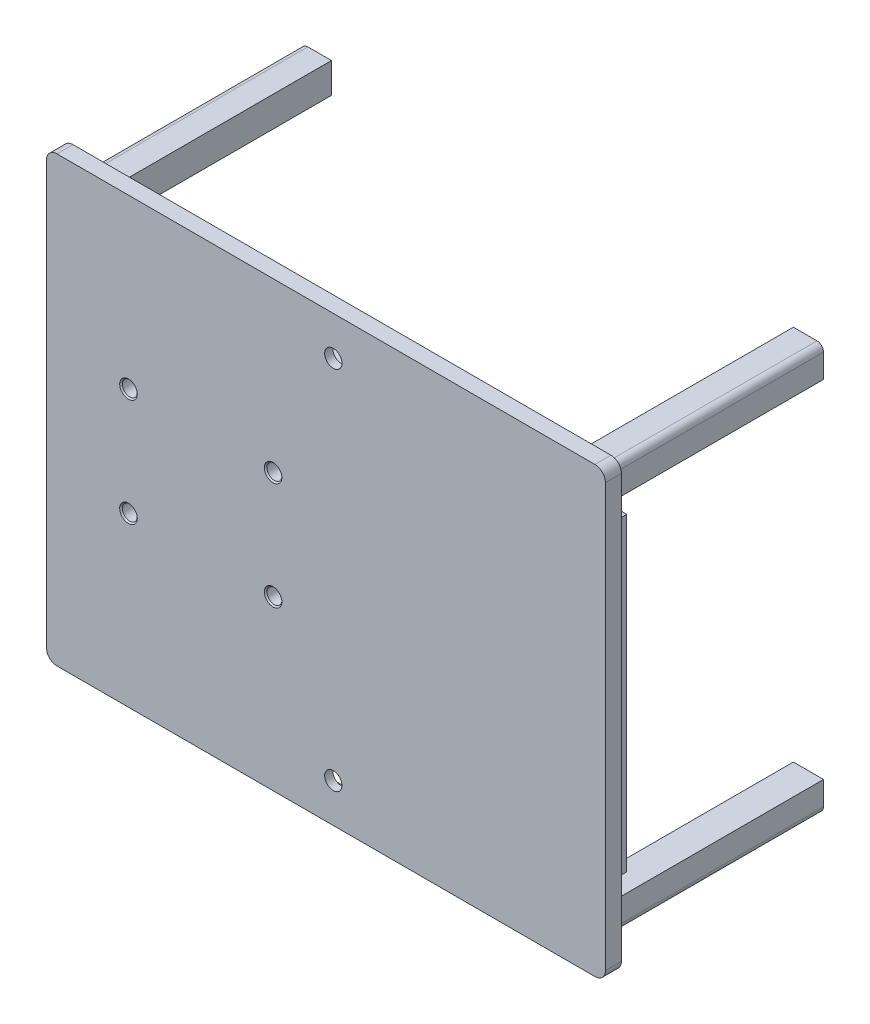
from build123d import *

# Parameters (mm, degrees)
SALIENTE_EXTRUIR1_DEPTH          = 3.1
SALIENTE_EXTRUIR2_DEPTH          = 3
SALIENTE_EXTRUIR3_DEPTH          = 3
TALADRO_DE_MARGEN_PARA_M41_D     = 4.5
TALADRO_DE_MARGEN_PARA_M41_DEPTH = 8.2
TALADRO_DE_MARGEN_PARA_M41_TIP   = 1.351936393
CROQUIS10_W                      = 11.5
CROQUIS10_H                      = 11.5
SALIENTE_EXTRUIR4_DEPTH          = 87
SALIENTE_EXTRUIR5_DEPTH          = 12
CROQUIS14_R                      = 2
CORTAR_EXTRUIR1_DEPTH            = 6
CHAFL_N1_SIZE                    = 0.3
TALADRO_DE_MARGEN_PARA_M61_D     = 6.6
TALADRO_DE_MARGEN_PARA_M61_DEPTH = 8.2
TALADRO_DE_MARGEN_PARA_M61_TIP   = 1.982840043
CORTAR_EXTRUIR3_DEPTH            = 12
REDONDEO1_R                      = 2.5
CROQUIS19_R                      = 6.15
SALIENTE_EXTRUIR6_DEPTH          = 12
CROQUIS20_R                      = 2.85
CORTAR_EXTRUIR4_DEPTH            = 8.2
CHAFL_N2_SIZE                    = 0.5


with BuildPart() as part:
    # Croquis4 → Saliente-Extruir1 (new body)
    with BuildSketch(Plane(origin=(0, 0, 6.1), x_dir=(-1, 0, 0), z_dir=(0, 0, -1))):
        with BuildLine():
            Line((-120.1, -80.5), (-120.1, 80.5))
            ThreePointArc((-120.1, 80.5), (-121.271572875, 83.328427125), (-124.1, 84.5))
            Line((-124.1, 84.5), (-329.1, 84.5))
            ThreePointArc((-329.1, 84.5), (-331.928427125, 83.328427125), (-333.1, 80.5))
            Line((-333.1, 80.5), (-333.1, -80.5))
            ThreePointArc((-333.1, -80.5), (-331.928427125, -83.328427125), (-329.1, -84.5))
            Line((-329.1, -84.5), (-124.1, -84.5))
            ThreePointArc((-124.1, -84.5), (-121.271572875, -83.328427125), (-120.1, -80.5))
        make_face()
    extrude(amount=SALIENTE_EXTRUIR1_DEPTH)



with BuildPart() as body_2:
    # Croquis5 → Saliente-Extruir2 (new body)
    with BuildSketch(Plane(origin=(0, 0, 3), x_dir=(-1, 0, 0), z_dir=(0, 0, -1))):
        with BuildLine():
            Line((-326.1, 59), (-326.1, -59))
            Line((-326.1, -59), (-326.1, -75))
            ThreePointArc((-326.1, -75), (-325.367766953, -76.767766953), (-323.6, -77.5))
            Line((-323.6, -77.5), (-129.6, -77.5))
            ThreePointArc((-129.6, -77.5), (-127.832233047, -76.767766953), (-127.1, -75))
            Line((-127.1, -75), (-127.1, 75))
            ThreePointArc((-127.1, 75), (-127.832233047, 76.767766953), (-129.6, 77.5))
            Line((-129.6, 77.5), (-323.6, 77.5))
            ThreePointArc((-323.6, 77.5), (-325.367766953, 76.767766953), (-326.1, 75))
            Line((-326.1, 75), (-326.1, 59))
        make_face()
        with BuildLine():
            Line((-324.1, 59), (-324.1, -59))
            Line((-324.1, -59), (-324.1, -75))
            ThreePointArc((-324.1, -75), (-323.953553391, -75.353553391), (-323.6, -75.5))
            Line((-323.6, -75.5), (-129.6, -75.5))
            ThreePointArc((-129.6, -75.5), (-129.246446609, -75.353553391), (-129.1, -75))
            Line((-129.1, -75), (-129.1, 75))
            ThreePointArc((-129.1, 75), (-129.246446609, 75.353553391), (-129.6, 75.5))
            Line((-129.6, 75.5), (-323.6, 75.5))
            ThreePointArc((-323.6, 75.5), (-323.953553391, 75.353553391), (-324.1, 75))
            Line((-324.1, 75), (-324.1, 59))
        make_face(mode=Mode.SUBTRACT)
    extrude(amount=SALIENTE_EXTRUIR2_DEPTH)


with BuildPart() as part_1:
    add(part.part)

    add(body_2.part)  # Saliente-Extruir3 merges body 2
    # Croquis6 → Saliente-Extruir3 (add)
    with BuildSketch(Plane(origin=(0, 0, 3), x_dir=(-1, 0, 0), z_dir=(0, 0, -1))):
        with BuildLine():
            Line((-120.1, -80.5), (-120.1, 80.5))
            ThreePointArc((-120.1, 80.5), (-121.271572875, 83.328427125), (-124.1, 84.5))
            Line((-124.1, 84.5), (-329.1, 84.5))
            ThreePointArc((-329.1, 84.5), (-331.928427125, 83.328427125), (-333.1, 80.5))
            Line((-333.1, 80.5), (-333.1, -80.5))
            ThreePointArc((-333.1, -80.5), (-331.928427125, -83.328427125), (-329.1, -84.5))
            Line((-329.1, -84.5), (-124.1, -84.5))
            ThreePointArc((-124.1, -84.5), (-121.271572875, -83.328427125), (-120.1, -80.5))
        make_face()
        with BuildLine():
            Line((-122.1, -80.5), (-122.1, 80.5))
            ThreePointArc((-122.1, 80.5), (-122.685786438, 81.914213562), (-124.1, 82.5))
            Line((-124.1, 82.5), (-329.1, 82.5))
            ThreePointArc((-329.1, 82.5), (-330.514213562, 81.914213562), (-331.1, 80.5))
            Line((-331.1, 80.5), (-331.1, -80.5))
            ThreePointArc((-331.1, -80.5), (-330.514213562, -81.914213562), (-329.1, -82.5))
            Line((-329.1, -82.5), (-124.1, -82.5))
            ThreePointArc((-124.1, -82.5), (-122.685786438, -81.914213562), (-122.1, -80.5))
        make_face(mode=Mode.SUBTRACT)
    extrude(amount=SALIENTE_EXTRUIR3_DEPTH)

    # Taladro de margen para M41
    with Locations(Plane.XY.offset(6.1)):
        with Locations((151.35, 20.5), (206.45, 20.5), (206.45, -20.5), (151.35, -20.5)):
            Hole(TALADRO_DE_MARGEN_PARA_M41_D / 2, depth=TALADRO_DE_MARGEN_PARA_M41_DEPTH)
            with Locations((0, 0, -(TALADRO_DE_MARGEN_PARA_M41_DEPTH + TALADRO_DE_MARGEN_PARA_M41_TIP / 2))):  # 118° drill point
                Cone(0, TALADRO_DE_MARGEN_PARA_M41_D / 2, TALADRO_DE_MARGEN_PARA_M41_TIP, mode=Mode.SUBTRACT)

    # Croquis10 → Saliente-Extruir4 (add)
    with BuildSketch(Plane(origin=(0, 0, 3), x_dir=(-1, 0, 0), z_dir=(0, 0, -1))):
        with Locations((-132.85, 71.75)):
            Rectangle(CROQUIS10_W, CROQUIS10_H)
        with Locations((-132.85, -71.75)):
            Rectangle(CROQUIS10_W, CROQUIS10_H)
        with Locations((-320.35, -71.75)):
            Rectangle(CROQUIS10_W, CROQUIS10_H)
        with Locations((-320.35, 71.75)):
            Rectangle(CROQUIS10_W, CROQUIS10_H)
    extrude(amount=SALIENTE_EXTRUIR4_DEPTH)

    # Croquis13 → Saliente-Extruir5 (add)
    with BuildSketch(Plane(origin=(0, 0, 3), x_dir=(-1, 0, 0), z_dir=(0, 0, -1))):
        Polygon((-213.1, -55), (-323.1, -55), (-323.1, 55), (-213.1, 55), (-213.1, 21.5), (-209.1, 21.5), (-209.1, 59), (-326.1, 59), (-326.1, -59), (-209.1, -59), (-209.1, -21.5), (-213.1, -21.5), align=None)
    extrude(amount=SALIENTE_EXTRUIR5_DEPTH)

    # Croquis14 → Cortar-Extruir1 (cut)
    with BuildSketch(Plane(origin=(0, 0, -84), x_dir=(-1, 0, 0), z_dir=(0, 0, -1))):
        with Locations((-132.85, -71.75)):
            Circle(CROQUIS14_R)
        with Locations((-132.85, 71.75)):
            Circle(CROQUIS14_R)
        with Locations((-320.35, 71.75)):
            Circle(CROQUIS14_R)
        with Locations((-320.35, -71.75)):
            Circle(CROQUIS14_R)
    extrude(amount=-CORTAR_EXTRUIR1_DEPTH, mode=Mode.SUBTRACT)

    # Chaflán1
    chafl_n1_edges = [part_1.edges().sort_by_distance(p)[0] for p in [
        (322.35, -71.75, -84),
        (322.35, 71.75, -84),
        (134.85, 71.75, -84),
        (134.85, -71.75, -84),
    ]]
    chamfer(chafl_n1_edges, length=CHAFL_N1_SIZE)

    # Taladro de margen para M61
    with Locations(Plane.XY.offset(6.1)):
        with Locations((229.4, 69.675), (229.4, -69.675)):
            Hole(TALADRO_DE_MARGEN_PARA_M61_D / 2, depth=TALADRO_DE_MARGEN_PARA_M61_DEPTH)
            with Locations((0, 0, -(TALADRO_DE_MARGEN_PARA_M61_DEPTH + TALADRO_DE_MARGEN_PARA_M61_TIP / 2))):  # 118° drill point
                Cone(0, TALADRO_DE_MARGEN_PARA_M61_D / 2, TALADRO_DE_MARGEN_PARA_M61_TIP, mode=Mode.SUBTRACT)

    # Croquis18 → Cortar-Extruir3 (cut)
    with BuildSketch(Plane(origin=(0, 0, -9), x_dir=(-1, 0, 0), z_dir=(0, 0, -1))):
        Polygon((-212.6, 21.5), (-212.6, 55.5), (-323.6, 55.5), (-323.6, -55.5), (-212.6, -55.5), (-212.6, -21.5), (-213.1, -21.5), (-213.1, -55), (-323.1, -55), (-323.1, 55), (-213.1, 55), (-213.1, 21.5), align=None)
    extrude(amount=-CORTAR_EXTRUIR3_DEPTH, mode=Mode.SUBTRACT)

    # Redondeo1
    redondeo1_edges = [part_1.edges().sort_by_distance(p)[0] for p in [
        (127.1, 77.5, -40.5),
        (127.1, -77.5, -40.5),
        (326.1, -77.5, -40.5),
        (326.1, 77.5, -40.5),
    ]]
    fillet(redondeo1_edges, radius=REDONDEO1_R)

    # Croquis19 → Saliente-Extruir6 (add)
    with BuildSketch(Plane(origin=(0, 0, 3), x_dir=(-1, 0, 0), z_dir=(0, 0, -1))):
        with Locations(Location((-151.35, -20.5, 0), (0, 0, 270))):
            Circle(CROQUIS19_R)
        with Locations(Location((-151.35, 20.5, 0), (0, 0, 270))):
            Circle(CROQUIS19_R)
        with Locations((-206.45, 20.5)):
            Circle(CROQUIS19_R)
        with Locations((-206.45, -20.5)):
            Circle(CROQUIS19_R)
    extrude(amount=SALIENTE_EXTRUIR6_DEPTH)

    # Croquis20 → Cortar-Extruir4 (cut)
    with BuildSketch(Plane.XY.offset(6.1)):
        with Locations((151.35, -20.5)):
            Circle(CROQUIS20_R)
        with Locations((206.45, -20.5)):
            Circle(CROQUIS20_R)
        with Locations((206.45, 20.5)):
            Circle(CROQUIS20_R)
        with Locations((151.35, 20.5)):
            Circle(CROQUIS20_R)
    extrude(amount=-CORTAR_EXTRUIR4_DEPTH, mode=Mode.SUBTRACT)

    # Chaflán2
    chafl_n2_edges = [part_1.edges().sort_by_distance(p)[0] for p in [
        (148.5, 20.5, 6.1),
        (203.6, 20.5, 6.1),
        (203.6, -20.5, 6.1),
        (148.5, -20.5, 6.1),
    ]]
    chamfer(chafl_n2_edges, length=CHAFL_N2_SIZE)


solid = part_1.part
